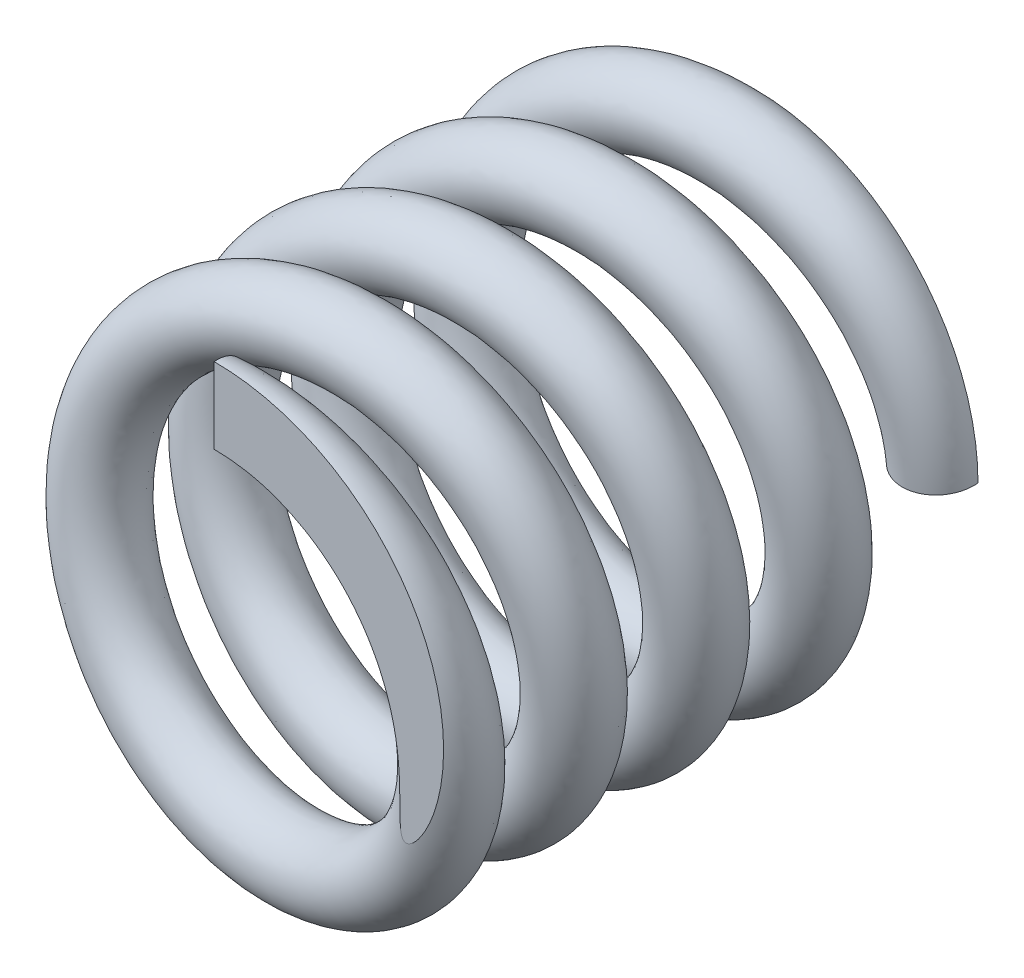
from build123d import *

# Parameters (mm, degrees)
S_P_R1_PITCH               = 4
S_P_R1_HEIGHT              = 17
S_P_R1_RADIUS              = 6.7
S_P_R1_START_ANGLE         = 90
IZIM3_R                    = 1.24
KES_EKSTR_ZYON1_DEPTH      = 22.427325153
KES_EKSTR_ZYON1_DEPTH_BACK = 22.427325153
IZIM4_W                    = 18.388584742
IZIM4_H                    = 3.490349357
IZIM4_H_2                  = 3.172480621


with BuildPart() as part:
    # Süpür1: sweep along a helix
    with BuildLine() as s_p_r1_path:
        add(Helix(S_P_R1_PITCH, S_P_R1_HEIGHT, S_P_R1_RADIUS, center=(0, 0, 0), direction=(0, 0, -1), mode=Mode.PRIVATE).rotate(Axis((0, 0, 0), (0, 0, -1)), S_P_R1_START_ANGLE))
    # Çizim3 → Süpür1 (sweep)
    with BuildSketch(Plane(origin=(0, 6.7, 0), x_dir=(-0.09459182965355081, 0, -0.9955161403828638), z_dir=(0.9955161403828638, 3.963365519184482e-15, -0.09459182965355081))):
        with Locations((0, 0.017218173)):
            Circle(IZIM3_R)
    sweep(path=s_p_r1_path.line, is_frenet=True)

    # Çizim4 → Kes-Ekstrüzyon1 (cut, two sides: drawn at the far end of the back side and taken through both)
    with BuildSketch(Plane(origin=(0, 0, 0), x_dir=(1, 0, 0), z_dir=(0, 1, 0)).offset(-KES_EKSTR_ZYON1_DEPTH_BACK)):
        with Locations((0.518350738, 18.745174678)):
            Rectangle(IZIM4_W, IZIM4_H)
        with Locations((0.518350738, -1.586240311)):
            Rectangle(IZIM4_W, IZIM4_H_2)
    extrude(amount=KES_EKSTR_ZYON1_DEPTH + KES_EKSTR_ZYON1_DEPTH_BACK, mode=Mode.SUBTRACT)


solid = part.part
